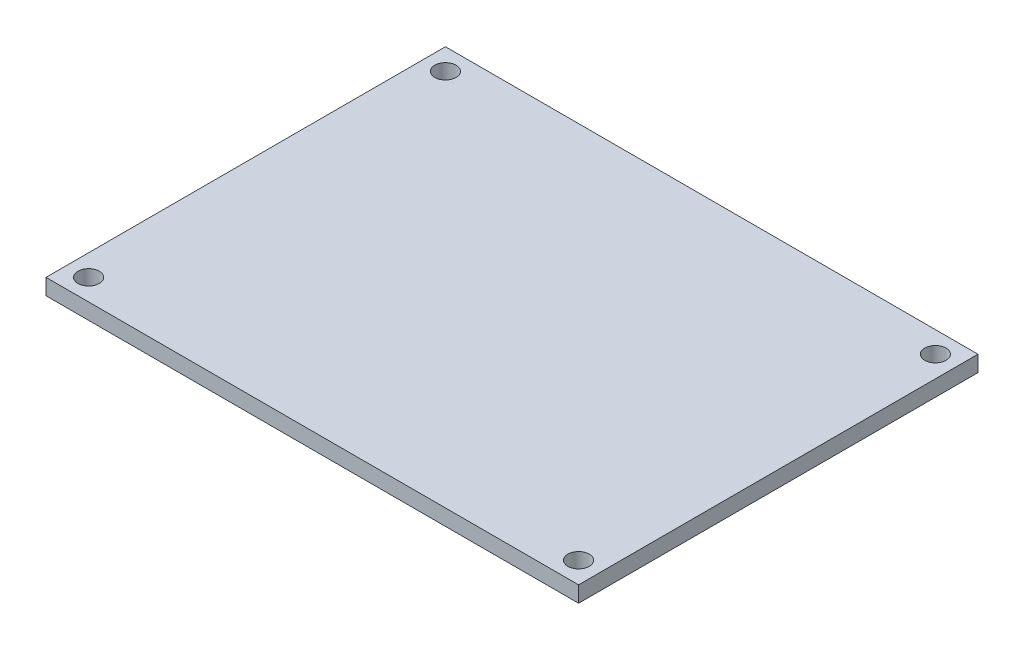
from build123d import *

# Parameters (mm, degrees)
SKETCH1_W           = 100
SKETCH1_H           = 75
SKETCH1_R           = 2
BOSS_EXTRUDE1_DEPTH = 3


with BuildPart() as part:
    # Sketch1 → Boss-Extrude1 (new body)
    with BuildSketch(Plane(origin=(0, 0, 0), x_dir=(1, 0, 0), z_dir=(0, 1, 0))):
        Rectangle(SKETCH1_W, SKETCH1_H)
        with Locations(Location((-46, -33.5, 0), (0, 0, 270))):
            Circle(SKETCH1_R, mode=Mode.SUBTRACT)
        with Locations(Location((46, -33.5, 0), (0, 0, 270))):
            Circle(SKETCH1_R, mode=Mode.SUBTRACT)
        with Locations(Location((46, 33.5, 0), (0, 0, 270))):
            Circle(SKETCH1_R, mode=Mode.SUBTRACT)
        with Locations(Location((-46, 33.5, 0), (0, 0, 270))):
            Circle(SKETCH1_R, mode=Mode.SUBTRACT)
    extrude(amount=BOSS_EXTRUDE1_DEPTH)


solid = part.part
